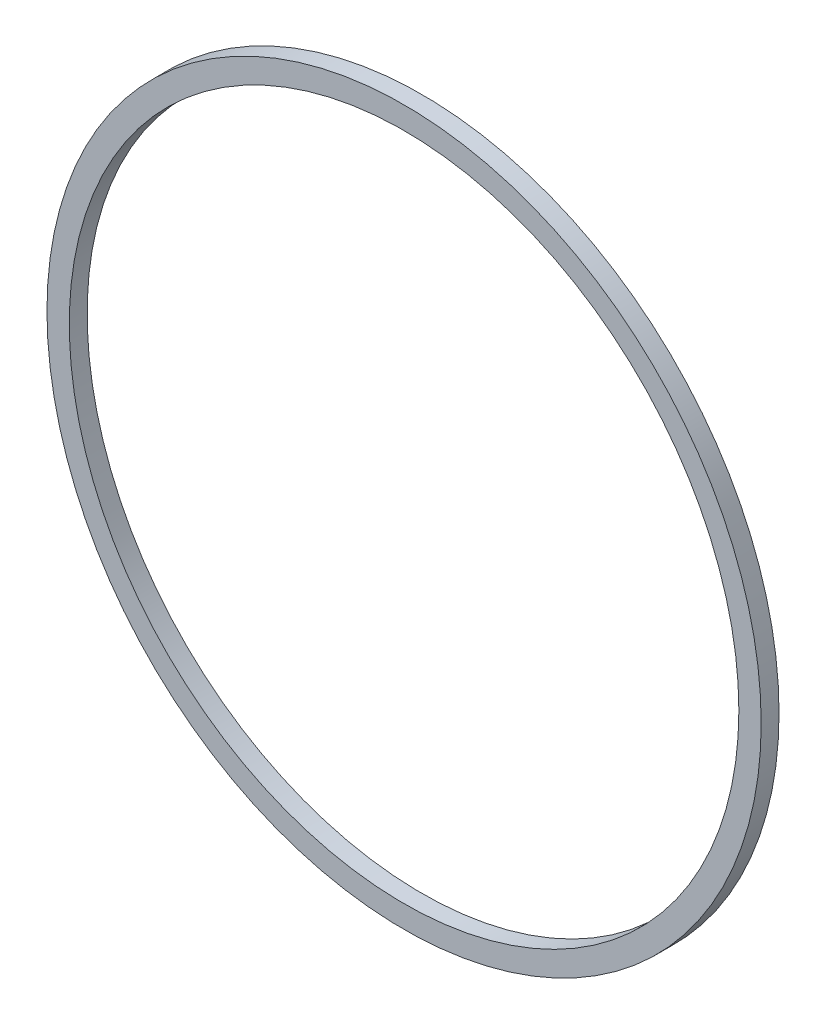
from build123d import *

# Parameters (mm, degrees)
SKETCH1_R           = 40
SKETCH1_R_2         = 37.5
BOSS_EXTRUDE3_DEPTH = 2


with BuildPart() as part:
    # Sketch1 → Boss-Extrude3 (new body)
    with BuildSketch(Plane.XY):
        Circle(SKETCH1_R)
        Circle(SKETCH1_R_2, mode=Mode.SUBTRACT)
    extrude(amount=BOSS_EXTRUDE3_DEPTH)


solid = part.part
